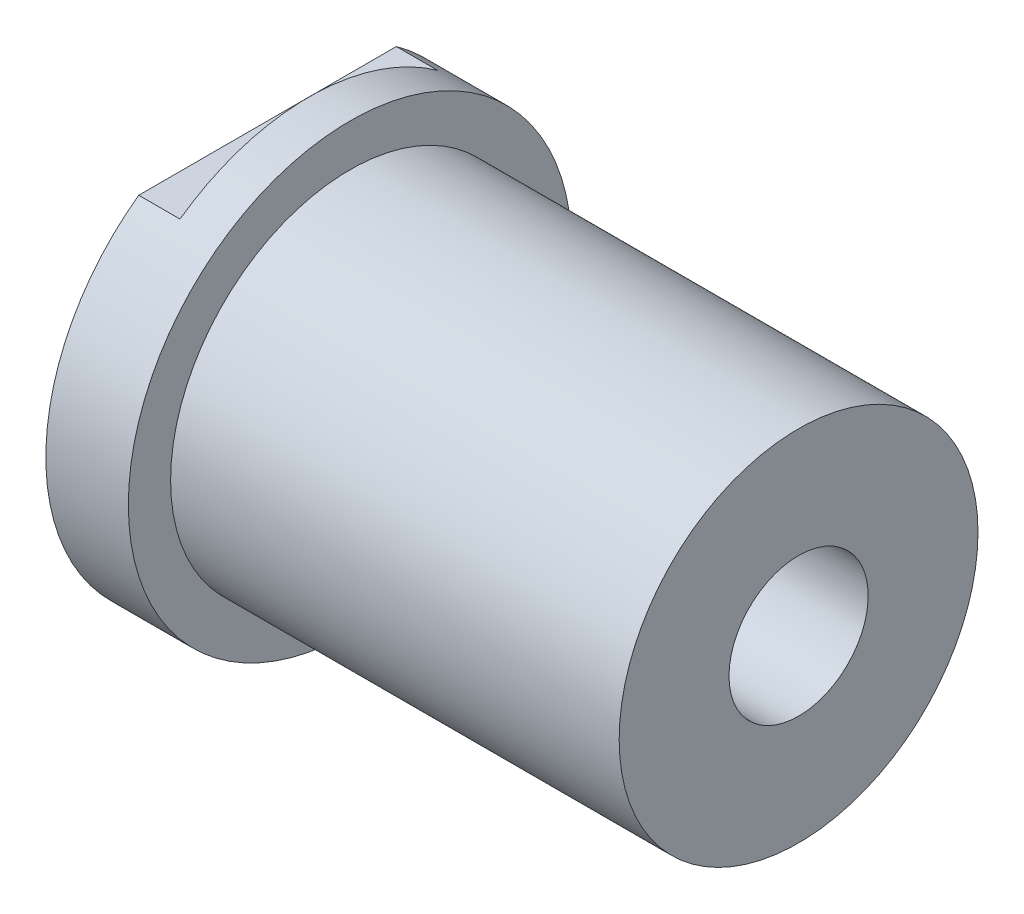
from build123d import *

# Parameters (mm, degrees)
ESQUISSE2_W                  = 103
ESQUISSE2_H                  = 43
ESQUISSE3_OUTSIDE_W          = 119.876
ESQUISSE3_OUTSIDE_H          = 119.876
ESQUISSE3_OUTSIDE_R          = 34.8
ENL_V_MAT_EXTRU_1_DEPTH      = 87
ENL_V_MAT_EXTRU_2_DEPTH      = 120.61187232
ENL_V_MAT_EXTRU_2_DEPTH_BACK = 8
ENL_V_MAT_EXTRU_3_DEPTH      = 120.61187232
ENL_V_MAT_EXTRU_3_DEPTH_BACK = 8
ESQUISSE7_R                  = 19.5
ENL_V_MAT_EXTRU_4_DEPTH      = 24
ESQUISSE8_R                  = 13.5
ENL_V_MAT_EXTRU_5_DEPTH      = 100.694533451


with BuildPart() as part:
    # Esquisse2 → Révolution1 (revolve)
    with BuildSketch(Plane.XY, mode=Mode.PRIVATE) as r_volution1_sk:
        with Locations((51.5, 21.5)):
            Rectangle(ESQUISSE2_W, ESQUISSE2_H)
    revolve(r_volution1_sk.sketch.rotate(Axis((103, 0, 0), (-1, 0, 0)), 90), axis=Axis((103, 0, 0), (-1, 0, 0)))

    # Esquisse3 outside → Enlèv. mat.-Extru.1 (cut)
    with BuildSketch(Plane(origin=(103, 0, 0), x_dir=(0, 0, -1), z_dir=(1, 0, 0))):
        Rectangle(ESQUISSE3_OUTSIDE_W, ESQUISSE3_OUTSIDE_H)
        Circle(ESQUISSE3_OUTSIDE_R, mode=Mode.SUBTRACT)
    extrude(amount=-ENL_V_MAT_EXTRU_1_DEPTH, mode=Mode.SUBTRACT)

    # Esquisse4 → Enlèv. mat.-Extru.2 (cut, two sides: drawn at the far end of the back side and taken through both)
    with BuildSketch(Plane.ZY.offset(-ENL_V_MAT_EXTRU_2_DEPTH_BACK)):
        Polygon((-241.912631386, 35), (-24.979991994, 35), (24.979991994, 35), (241.912631386, 35), (241.912631386, 468.865278784), (-241.912631386, 468.865278784), align=None)
    extrude(amount=ENL_V_MAT_EXTRU_2_DEPTH + ENL_V_MAT_EXTRU_2_DEPTH_BACK, mode=Mode.SUBTRACT)

    # Esquisse5 → Enlèv. mat.-Extru.3 (cut, two sides: drawn at the far end of the back side and taken through both)
    with BuildSketch(Plane.ZY.offset(-ENL_V_MAT_EXTRU_3_DEPTH_BACK)):
        Polygon((-241.912631386, -35), (-24.979991994, -35), (24.979991994, -35), (241.912631386, -35), (241.912631386, -468.865278784), (-241.912631386, -468.865278784), align=None)
    extrude(amount=ENL_V_MAT_EXTRU_3_DEPTH + ENL_V_MAT_EXTRU_3_DEPTH_BACK, mode=Mode.SUBTRACT)

    # Esquisse7 → Enlèv. mat.-Extru.4 (cut)
    with BuildSketch(Plane.ZY):
        Circle(ESQUISSE7_R)
    extrude(amount=-ENL_V_MAT_EXTRU_4_DEPTH, mode=Mode.SUBTRACT)

    # Esquisse8 → Enlèv. mat.-Extru.5 (cut, through all)
    with BuildSketch(Plane.ZY.offset(-24)):
        Circle(ESQUISSE8_R)
    extrude(amount=-ENL_V_MAT_EXTRU_5_DEPTH, mode=Mode.SUBTRACT)


solid = part.part
